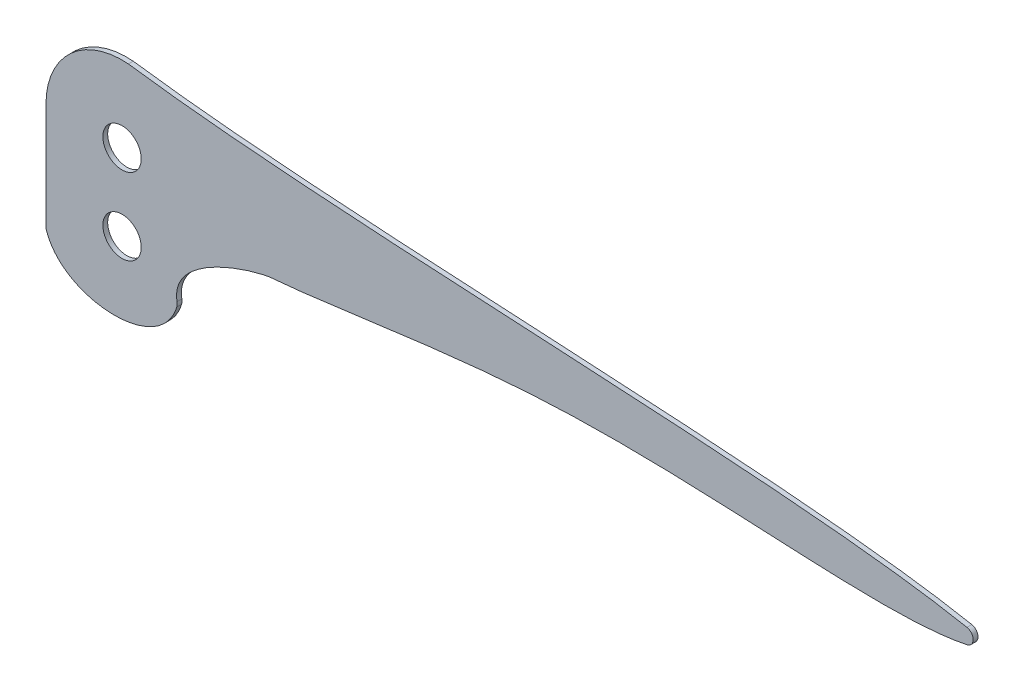
from build123d import *

# Parameters (mm, degrees)
SKETCH1_R           = 6.35
BOSS_EXTRUDE1_DEPTH = 1.6002


with BuildPart() as part:
    # Sketch1 → Boss-Extrude1 (new body)
    with BuildSketch(Plane.XY):
        with BuildLine():
            Line((-25.191875828, 0), (-25.191875828, -35.215356132))
            ThreePointArc((-25.191875828, -35.215356132), (-25.144594979, -35.781140778), (-25.004063999, -36.331230578))
            add(Edge.make_bspline(
                [(-25.004063999, -36.331230578), (-24.302161584, -38.357321078), (-17.500345693, -49.472928078), (6.486565439, -52.353017034), (16.828257208, -40.890808587), (18.117618202, -36.640731795)],
                knots=[0.011286064, 0.011286064, 0.011286064, 0.011286064, 0.130987572, 0.750185474, 0.983991621, 0.983991621, 0.983991621, 0.983991621], degree=3))
            ThreePointArc((18.117618202, -36.640731795), (18.258374718, -35.854153527), (18.212152653, -35.056418427))
            add(Edge.make_bspline(
                [(18.212152653, -35.056418427), (15.722327617, -21.003254002), (45.083704914, -12.577387864), (50.314621311, -12.487786805)],
                knots=[0.243688719, 0.243688719, 0.243688719, 0.243688719, 1, 1, 1, 1], degree=3))
            add(Edge.make_bspline(
                [(50.314621311, -12.487786805), (67.828969762, -11.217353563), (162.851239243, 6.097445829), (250.038282618, -9.041784468), (279.934807735, -2.602592093)],
                knots=[0.23584572, 0.23584572, 0.23584572, 0.23584572, 0.495200792, 0.941477437, 0.941477437, 0.941477437, 0.941477437], degree=3))
            ThreePointArc((279.934807735, -2.602592093), (281.939894054, -0.09633433), (279.889362488, 2.372880002))
            add(Edge.make_bspline(
                [(2.090204907, 25.105012471), (29.372633882, 21.318909318), (128.041674084, 14.540572725), (239.548411309, 10.293455518), (279.889362488, 2.372880002)],
                knots=[0.008543469, 0.008543469, 0.008543469, 0.008543469, 0.340594684, 0.94139515, 0.94139515, 0.94139515, 0.94139515], degree=3))
            ThreePointArc((2.090204907, 25.105012471), (-17.058347301, 18.537621075), (-25.191875828, 0))
        make_face()
        with Locations((0, -25.4)):
            Circle(SKETCH1_R, mode=Mode.SUBTRACT)
        Circle(SKETCH1_R, mode=Mode.SUBTRACT)
    extrude(amount=BOSS_EXTRUDE1_DEPTH)


solid = part.part
